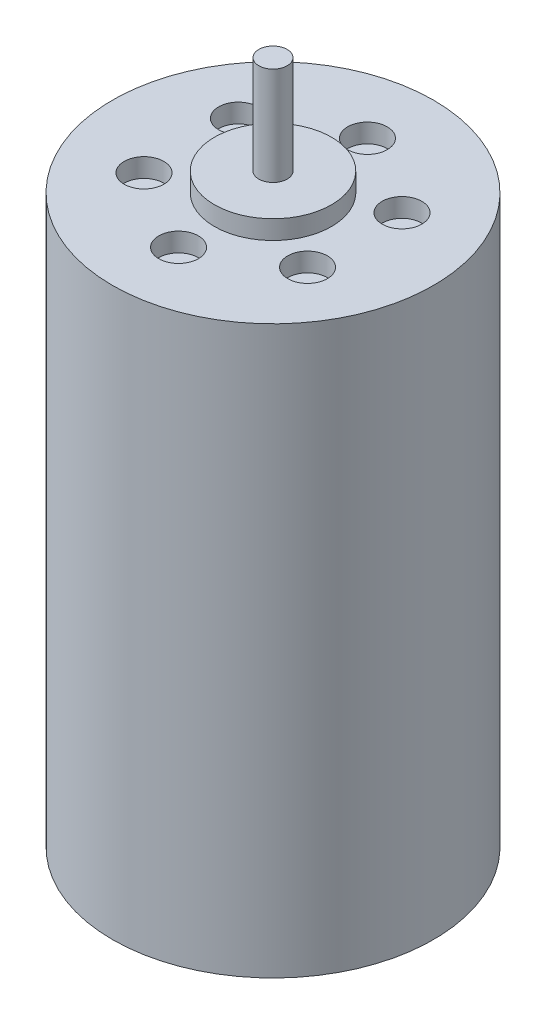
from build123d import *

# Parameters (mm, degrees)
SKETCH_1_R          = 8.5
EXTRUDE_1_DEPTH     = 30
SKETCH_2_R          = 3.1
EXTRUDE_2_DEPTH     = 1
SKETCH_3_R          = 0.75
EXTRUDE_3_DEPTH     = 5.2
SKETCH_4_R          = 1.05
CUT_EXTRUDE_1_DEPTH = 1


with BuildPart() as part:
    # 草图1 → 凸台-拉伸1 (new body)
    with BuildSketch(Plane(origin=(0, 0, 0), x_dir=(1, 0, 0), z_dir=(0, 1, 0))):
        with Locations(Location((0, 0, 0), (0, 0, 270))):
            Circle(SKETCH_1_R)
    extrude(amount=EXTRUDE_1_DEPTH)

    # 草图2 → 凸台-拉伸2 (add)
    with BuildSketch(Plane(origin=(0, 30, 0), x_dir=(1, 0, 0), z_dir=(0, 1, 0))):
        with Locations(Location((0, 0, 0), (0, 0, 270))):
            Circle(SKETCH_2_R)
    extrude(amount=EXTRUDE_2_DEPTH)

    # 草图3 → 凸台-拉伸3 (add)
    with BuildSketch(Plane(origin=(0, 31, 0), x_dir=(1, 0, 0), z_dir=(0, 1, 0))):
        with Locations(Location((0, 0, 0), (0, 0, 270))):
            Circle(SKETCH_3_R)
    extrude(amount=EXTRUDE_3_DEPTH)

    # 草图4 → 切除-拉伸1 (cut)
    with BuildSketch(Plane(origin=(0, 30, 0), x_dir=(1, 0, 0), z_dir=(0, 1, 0))):
        with Locations(Location((0, 5, 0), (0, 0, 270))):
            Circle(SKETCH_4_R)
        with Locations(Location((4.330127019, 2.5, 0), (0, 0, 270))):
            Circle(SKETCH_4_R)
        with Locations(Location((4.330127019, -2.5, 0), (0, 0, 270))):
            Circle(SKETCH_4_R)
        with Locations(Location((0, -5, 0), (0, 0, 270))):
            Circle(SKETCH_4_R)
        with Locations(Location((-4.330127019, -2.5, 0), (0, 0, 270))):
            Circle(SKETCH_4_R)
        with Locations(Location((-4.330127019, 2.5, 0), (0, 0, 270))):
            Circle(SKETCH_4_R)
    extrude(amount=-CUT_EXTRUDE_1_DEPTH, mode=Mode.SUBTRACT)


solid = part.part
